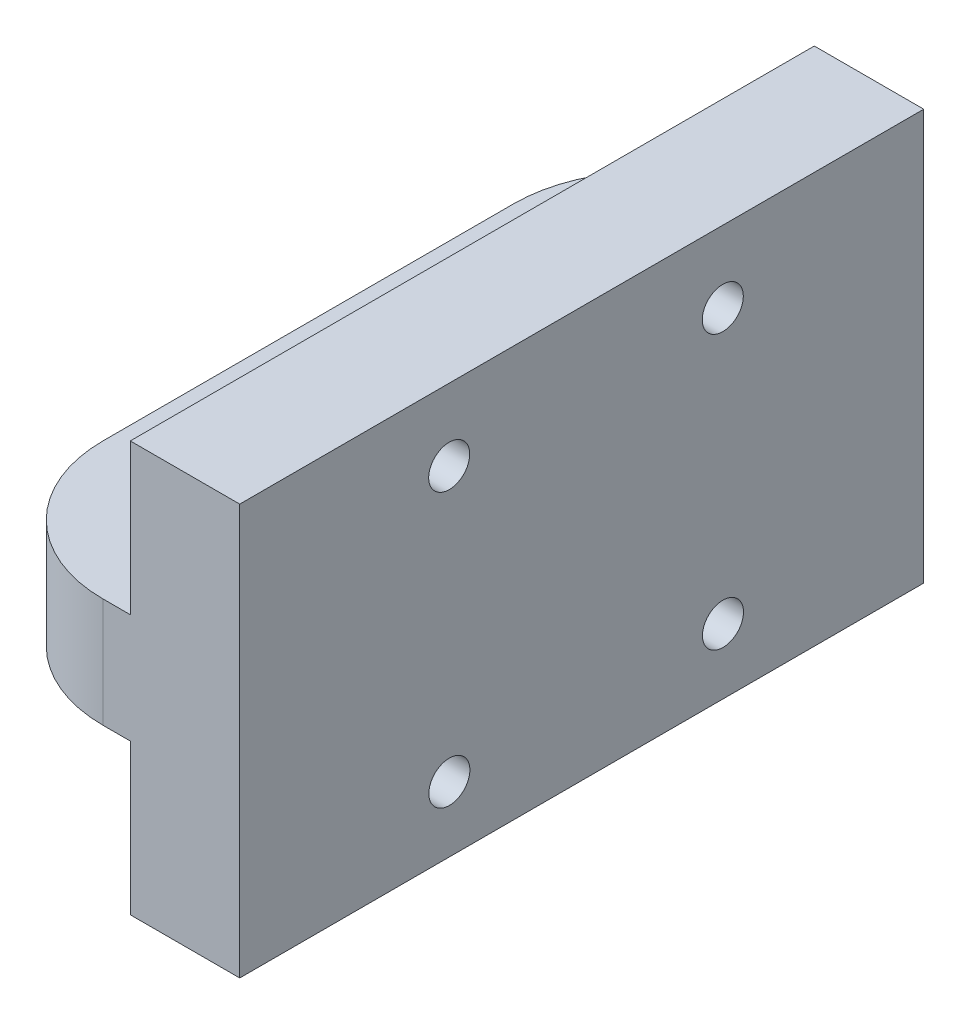
from build123d import *

# Parameters (mm, degrees)
SKETCH1_W           = 20
SKETCH1_H           = 50
BOSS_EXTRUDE1_DEPTH = 8
FILLET1_R           = 10
SKETCH2_W           = 50
SKETCH2_H           = 30
BOSS_EXTRUDE2_DEPTH = 8
SKETCH3_R           = 1.5
CUT_EXTRUDE1_DEPTH  = 8


with BuildPart() as part:
    # Sketch1 → Boss-Extrude1 (new body)
    with BuildSketch(Plane(origin=(0, 0, 0), x_dir=(1, 0, 0), z_dir=(0, 1, 0))):
        with Locations((10, 25)):
            Rectangle(SKETCH1_W, SKETCH1_H)
    extrude(amount=BOSS_EXTRUDE1_DEPTH)

    # Fillet1
    fillet1_edges = [part.edges().sort_by_distance(p)[0] for p in [
        (0, 4, -50),
        (0, 4, 0),
    ]]
    fillet(fillet1_edges, radius=FILLET1_R)

    # Sketch2 → Boss-Extrude2 (add)
    with BuildSketch(Plane(origin=(20, 0, 0), x_dir=(0, 0, -1), z_dir=(1, 0, 0))):
        with Locations((25, 4)):
            Rectangle(SKETCH2_W, SKETCH2_H)
    extrude(amount=-BOSS_EXTRUDE2_DEPTH)

    # Sketch3 → Cut-Extrude1 (cut)
    with BuildSketch(Plane(origin=(20, 0, 0), x_dir=(0, 0, -1), z_dir=(1, 0, 0))):
        with Locations((15.311973507, 13.760568851)):
            Circle(SKETCH3_R)
        with Locations((15.324315829, -6.23942734)):
            Circle(SKETCH3_R)
        with Locations((35.311973507, 13.760568851)):
            Circle(SKETCH3_R)
        with Locations((35.324315829, -6.23942734)):
            Circle(SKETCH3_R)
    extrude(amount=-CUT_EXTRUDE1_DEPTH, mode=Mode.SUBTRACT)


solid = part.part
